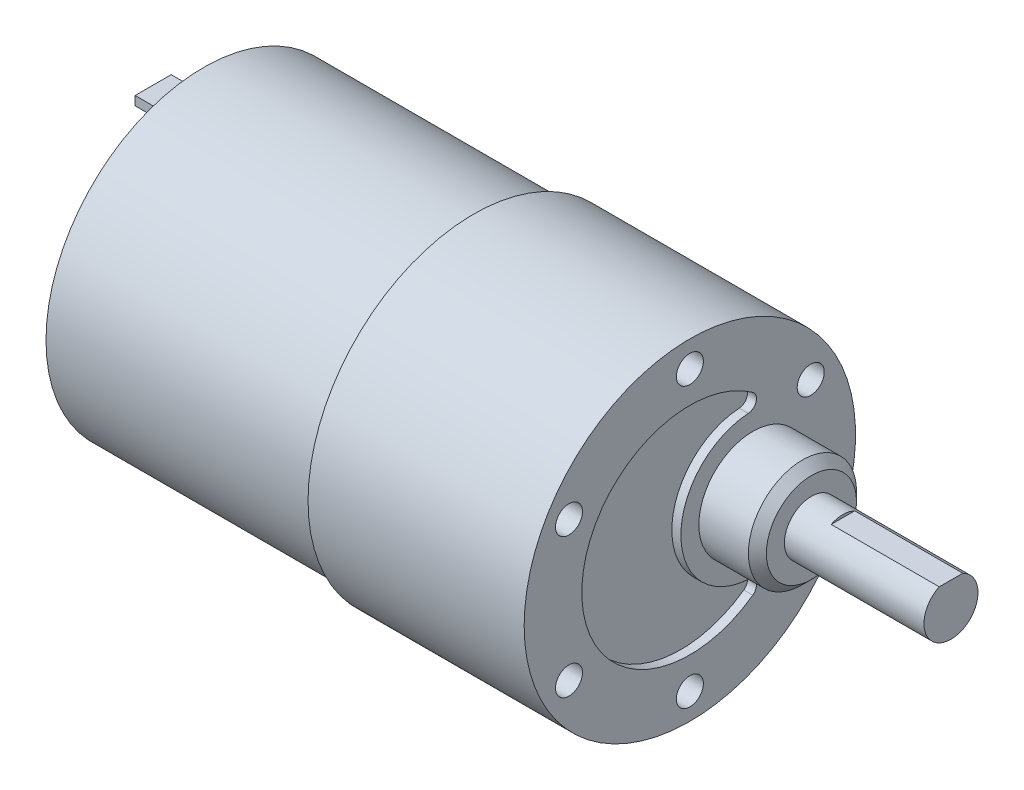
from build123d import *

# Parameters (mm, degrees)
ESQUISSE2_R             = 1.5
ENL_V_MAT_EXTRU_1_DEPTH = 10
ENL_V_MAT_EXTRU_2_DEPTH = 1
BOSS_EXTRU_2_DEPTH      = 2
BOSS_EXTRU_2_DEPTH_BACK = 2
ESQUISSE7_W             = 5.6
ESQUISSE7_H             = 1
ESQUISSE9_OUTSIDE_W     = 58.156
ESQUISSE9_OUTSIDE_H     = 58.156
ENL_V_MAT_EXTRU_3_DEPTH = 12


with BuildPart() as part:
    # Esquisse1 → Révolution1 (revolve)
    with BuildSketch(Plane.XY):
        Polygon((30, 17.5), (30, 18.4), (54, 18.4), (54, 0), (0, 0), (0, 17.5), align=None)
    revolve(axis=Axis((0, 0, 0), (1, 0, 0)))

    # Esquisse2 → Enlèv. mat.-Extru.1 (cut)
    with BuildSketch(Plane(origin=(54, 0, 0), x_dir=(0, 0, -1), z_dir=(1, 0, 0))):
        with Locations((0, 15.5)):
            Circle(ESQUISSE2_R)
        with Locations((13.423393759, 7.75)):
            Circle(ESQUISSE2_R)
        with Locations((13.423393759, -7.75)):
            Circle(ESQUISSE2_R)
        with Locations((0, -15.5)):
            Circle(ESQUISSE2_R)
        with Locations((-13.423393759, -7.75)):
            Circle(ESQUISSE2_R)
        with Locations((-13.423393759, 7.75)):
            Circle(ESQUISSE2_R)
    extrude(amount=-ENL_V_MAT_EXTRU_1_DEPTH, mode=Mode.SUBTRACT)

    # Esquisse5 → Révolution2 (revolve)
    with BuildSketch(Plane(origin=(0, 0, 0), x_dir=(1, 0, 0), z_dir=(0, 1, 0))):
        Polygon((54, 7), (76, 7), (76, 10), (60.5, 10), (60.5, 12), (59.5, 13), (54, 13), align=None)
    revolve(axis=Axis((54, 0, -7), (1, 0, 0)))

    # Esquisse6 → Enlèv. mat.-Extru.2 (cut)
    with BuildSketch(Plane(origin=(54, 0, 0), x_dir=(0, 0, -1), z_dir=(1, 0, 0))):
        with BuildLine():
            ThreePointArc((6.98802926, 9.755380416), (-12, 0), (6.98802926, -9.755380416))
            ThreePointArc((6.98802926, -9.755380416), (7.3591047, -8.690855421), (6.481545758, -7.983182649))
            ThreePointArc((6.481545758, -7.983182649), (-1, 0), (6.481545758, 7.983182649))
            ThreePointArc((6.481545758, 7.983182649), (7.3591047, 8.690855421), (6.98802926, 9.755380416))
        make_face()
    extrude(amount=-ENL_V_MAT_EXTRU_2_DEPTH, mode=Mode.SUBTRACT)

    # Esquisse7 → Boss.-Extru.2 (add, two sides: drawn at the far end of the back side and taken through both)
    with BuildSketch(Plane.XY.offset(-BOSS_EXTRU_2_DEPTH_BACK)):
        with Locations((-2.8, 12.5)):
            Rectangle(ESQUISSE7_W, ESQUISSE7_H)
        with Locations((-2.8, -12.5)):
            Rectangle(ESQUISSE7_W, ESQUISSE7_H)
    extrude(amount=BOSS_EXTRU_2_DEPTH + BOSS_EXTRU_2_DEPTH_BACK)

    # Esquisse8 → Révolution3 (revolve)
    with BuildSketch(Plane.XY):
        with BuildLine():
            Line((0, 0), (-1, 0))
            Line((-1, 0), (-1, 4.2))
            ThreePointArc((-1, 4.2), (-0.765685425, 4.765685425), (-0.2, 5))
            Line((-0.2, 5), (0, 5))
            Line((0, 5), (0, 0))
        make_face()
    revolve(axis=Axis((0, 0, 0), (-1, 0, 0)))

    # Esquisse9 outside → Enlèv. mat.-Extru.3 (cut)
    with BuildSketch(Plane(origin=(76, 0, 0), x_dir=(0, 0, -1), z_dir=(1, 0, 0))):
        Rectangle(ESQUISSE9_OUTSIDE_W, ESQUISSE9_OUTSIDE_H)
        with BuildLine():
            Line((5.692330317, 2.7), (8.307669683, 2.7))
            ThreePointArc((8.307669683, 2.7), (7, -3), (5.692330317, 2.7))
        make_face(mode=Mode.SUBTRACT)
    extrude(amount=-ENL_V_MAT_EXTRU_3_DEPTH, mode=Mode.SUBTRACT)


solid = part.part
